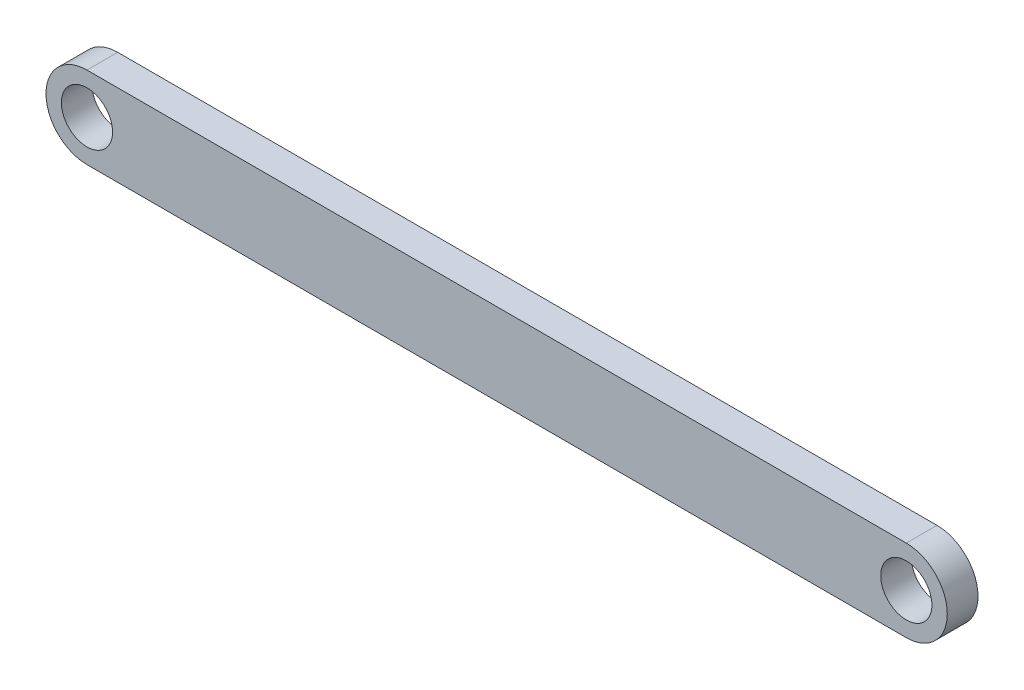
from build123d import *

# Parameters (mm, degrees)
SKETCH1_R           = 4
SKETCH1_W           = 80
SKETCH1_H           = 8
BOSS_EXTRUDE1_DEPTH = 3
SKETCH2_R           = 2.5
CUT_EXTRUDE1_DEPTH  = 3


with BuildPart() as part:
    # Sketch1 → Boss-Extrude1 (new body)
    with BuildSketch(Plane.XY):
        with Locations((-40, 0)):
            Circle(SKETCH1_R)
        with Locations((40, 0)):
            Circle(SKETCH1_R)
        Rectangle(SKETCH1_W, SKETCH1_H)
    extrude(amount=BOSS_EXTRUDE1_DEPTH)

    # Sketch2 → Cut-Extrude1 (cut)
    with BuildSketch(Plane.XY.offset(3)):
        with Locations((-40, 0)):
            Circle(SKETCH2_R)
        with Locations((40, 0)):
            Circle(SKETCH2_R)
    extrude(amount=-CUT_EXTRUDE1_DEPTH, mode=Mode.SUBTRACT)


solid = part.part
